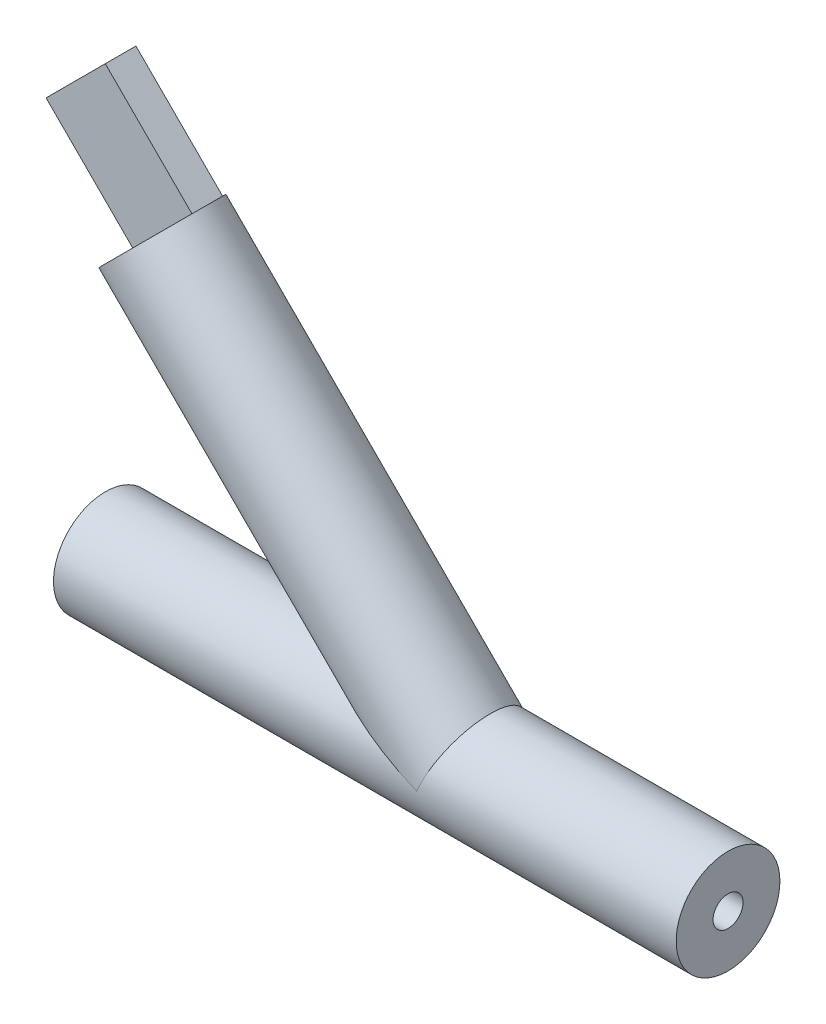
from build123d import *

# Parameters (mm, degrees)
SKETCH1_R           = 12.7
BOSS_EXTRUDE1_DEPTH = 152.4
SKETCH7_R           = 12.7
BOSS_EXTRUDE3_DEPTH = 106
SKETCH10_W          = 7.5
SKETCH10_H          = 20.497804761
BOSS_EXTRUDE8_DEPTH = 30
SKETCH11_R          = 3.675
CUT_EXTRUDE2_DEPTH  = 152.4


with BuildPart() as part:
    # Sketch1 → Boss-Extrude1 (new body)
    with BuildSketch(Plane(origin=(0, 0, 0), x_dir=(0, 0, -1), z_dir=(1, 0, 0))):
        with Locations(Location((0, 0, 0), (0, 0, 180))):
            Circle(SKETCH1_R)
    extrude(amount=BOSS_EXTRUDE1_DEPTH)

    # Sketch7 → Boss-Extrude3 (add)
    with BuildSketch(Plane(origin=(44.45, -44.45, 0), x_dir=(0.7071067811865464, 0.7071067811865488, 0), z_dir=(-0.7071067811865488, 0.7071067811865464, 0))):
        with Locations(Location((62.861792847, 0, 0), (0, 0, 90))):
            Circle(SKETCH7_R)
    extrude(amount=BOSS_EXTRUDE3_DEPTH)

    # Sketch10 → Boss-Extrude8 (add)
    with BuildSketch(Plane(origin=(-30.503318806, 30.503318806, 0), x_dir=(0, 0, 1), z_dir=(-0.7071067811865487, 0.7071067811865465, 0))):
        with Locations((-3.75, 62.861792848)):
            Rectangle(SKETCH10_W, SKETCH10_H)
    extrude(amount=BOSS_EXTRUDE8_DEPTH)

    # Sketch11 → Cut-Extrude2 (cut)
    with BuildSketch(Plane(origin=(152.4, 0, 0), x_dir=(0, 0, -1), z_dir=(1, 0, 0))):
        Circle(SKETCH11_R)
    extrude(amount=-CUT_EXTRUDE2_DEPTH, mode=Mode.SUBTRACT)


solid = part.part
